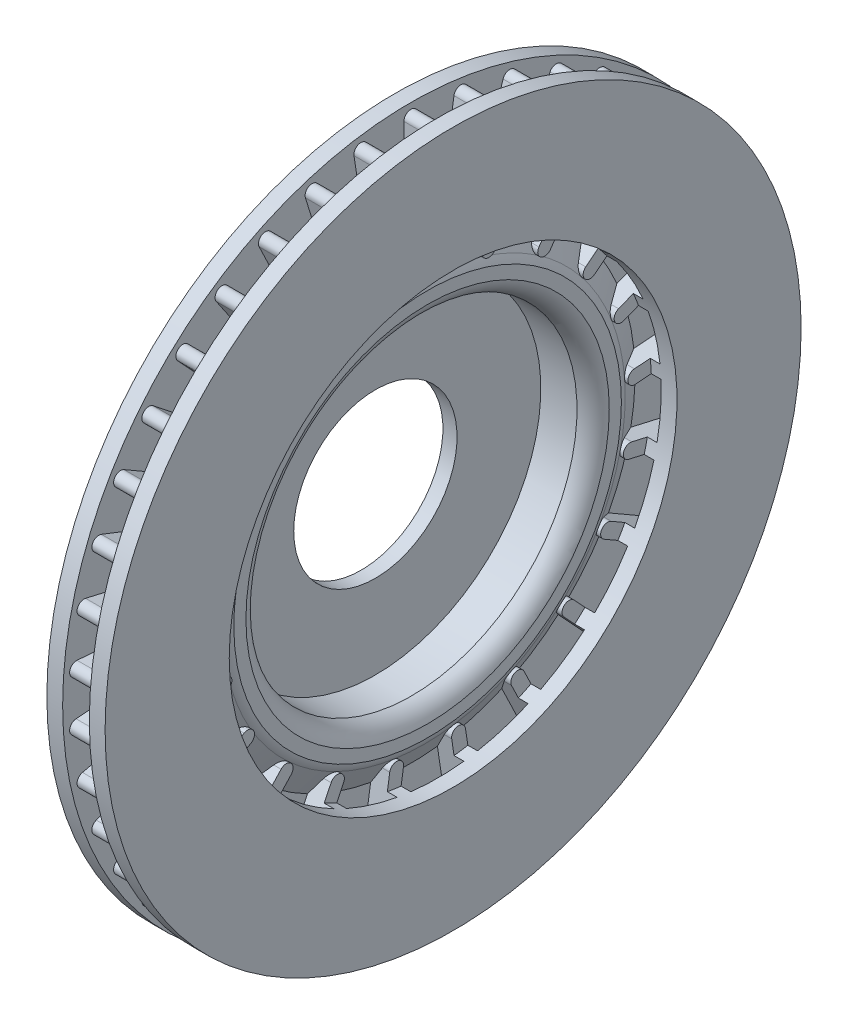
from build123d import *

# Parameters (mm, degrees)
Y_KSEKLIK_EKSTR_ZYON1_DEPTH = 11.4
DAIRESEL_KAPLAMA1_COUNT     = 21
IZIM3_W                     = 6.8
IZIM3_H                     = 71.1
IZIM4_W                     = 23.4
IZIM4_H                     = 96.5


with BuildPart() as part:
    # Çizim1 → Döndür1 (revolve)
    with BuildSketch(Plane.XY, mode=Mode.PRIVATE) as d_nd_r1_sk:
        with BuildLine():
            Line((0, 96.6), (0, 150.1))
            Line((0, 150.1), (6.8, 150.1))
            Line((6.8, 150.1), (6.8, 96.6))
            Line((6.8, 96.6), (12.573502692, 86.6))
            ThreePointArc((12.573502692, 86.6), (13.763162917, 77.545344817), (7.1, 71.3))
            Line((7.1, 71.3), (7.1, 75.9))
            Line((7.1, 75.9), (0, 75.9))
            Line((0, 75.9), (0, 76.9))
            Line((0, 76.9), (5, 76.9))
            ThreePointArc((5, 76.9), (6.646168116, 81.649570901), (5.773502692, 86.6))
            Line((5.773502692, 86.6), (0, 96.6))
        make_face()
    revolve(d_nd_r1_sk.sketch.rotate(Axis((-91.140344548, 0, 0), (1, 0, 0)), 90), axis=Axis((-91.140344548, 0, 0), (1, 0, 0)))

    # Çizim2 → Yükseklik-Ekstrüzyon1 (add)
    with BuildSketch(Plane(origin=(6.8, 0, 0), x_dir=(0, 0, -1), z_dir=(1, 0, 0))):
        with BuildLine():
            Line((18.566541212, 143.333644157), (14.799034997, 118.333644157))
            ThreePointArc((14.799034997, 118.333644157), (17.318485789, 114.920087697), (20.732042249, 117.439538489))
            Line((20.732042249, 117.439538489), (24.499548465, 142.439538489))
            ThreePointArc((24.499548465, 142.439538489), (21.980097672, 145.853094949), (18.566541212, 143.333644157))
        make_face()
        with BuildLine():
            Line((-3, 144.5), (-3, 96.553404911))
            ThreePointArc((-3, 96.553404911), (0, 96.6), (3, 96.553404911))
            Line((3, 96.553404911), (3, 144.5))
            ThreePointArc((3, 144.5), (2.121320344, 146.621320344), (0, 147.5))
            ThreePointArc((0, 147.5), (-2.121320344, 146.621320344), (-3, 144.5))
        make_face()
        with BuildLine():
            Line((-3, 96.553404911), (-3, 89.6))
            ThreePointArc((-3, 89.6), (0, 86.6), (3, 89.6))
            Line((3, 89.6), (3, 96.553404911))
            ThreePointArc((3, 96.553404911), (0, 96.6), (-3, 96.553404911))
        make_face()
    y_kseklik_ekstr_zyon1 = extrude(amount=Y_KSEKLIK_EKSTR_ZYON1_DEPTH)

    # Dairesel Kaplama1: Yükseklik-Ekstrüzyon1 ×21 about axis
    dairesel_kaplama1_axis = Axis((0, 0, 0), (1, 0, 0))
    for i in range(1, DAIRESEL_KAPLAMA1_COUNT):
        add(y_kseklik_ekstr_zyon1.rotate(dairesel_kaplama1_axis, i * 360 / DAIRESEL_KAPLAMA1_COUNT))

    # Çizim3 → Döndür2 (revolve)
    with BuildSketch(Plane.XY, mode=Mode.PRIVATE) as d_nd_r2_sk:
        with Locations((21.6, 114.45)):
            Rectangle(IZIM3_W, IZIM3_H)
    revolve(d_nd_r2_sk.sketch.rotate(Axis((-94.471118315, 0, 0), (1, 0, 0)), 90), axis=Axis((-94.471118315, 0, 0), (1, 0, 0)))

    # Çizim4 → Kes-Döndür1 (revolve, cut)
    with BuildSketch(Plane.XY, mode=Mode.PRIVATE) as kes_d_nd_r1_sk:
        with Locations((25.7, 48.25)):
            Rectangle(IZIM4_W, IZIM4_H)
    revolve(kes_d_nd_r1_sk.sketch.rotate(Axis((-57.600378102, 0, 0), (1, 0, 0)), 90), axis=Axis((-57.600378102, 0, 0), (1, 0, 0)), mode=Mode.SUBTRACT)

    # Çizim5 → Döndür6 (revolve)
    with BuildSketch(Plane.XY, mode=Mode.PRIVATE) as d_nd_r6_sk:
        Polygon((-14.6, 35.2), (-14.6, 76.9), (0, 76.9), (0, 75.9), (7.1, 75.9), (7.1, 71.3), (-8.5, 71.3), (-8.5, 35.2), align=None)
    revolve(d_nd_r6_sk.sketch.rotate(Axis((-62.081547895, 0, 0), (1, 0, 0)), 90), axis=Axis((-62.081547895, 0, 0), (1, 0, 0)))


solid = part.part
